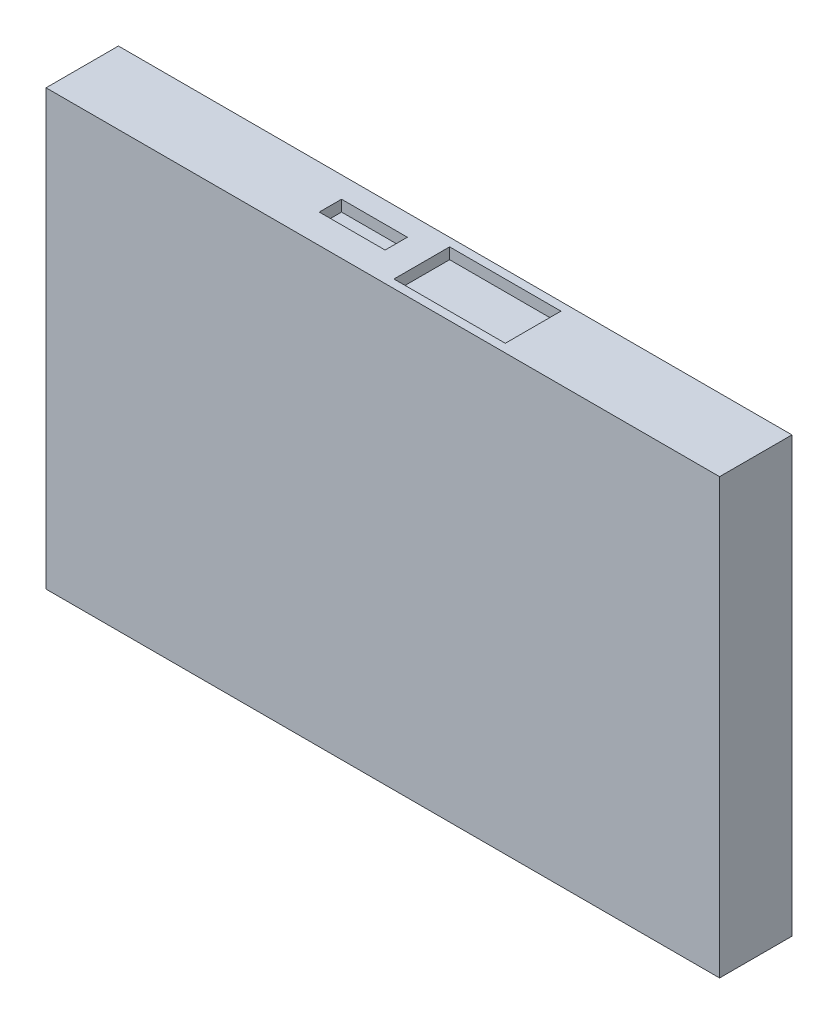
from build123d import *

# Parameters (mm, degrees)
SKETCH1_W           = 121
SKETCH1_H           = 78
BOSS_EXTRUDE1_DEPTH = 13
SKETCH2_W           = 115
SKETCH2_H           = 70
CUT_EXTRUDE1_DEPTH  = 1
SKETCH4_W           = 20
SKETCH4_H           = 10
SKETCH4_W_2         = 11.824806853
SKETCH4_H_2         = 3.99711781
CUT_EXTRUDE2_DEPTH  = 2


with BuildPart() as part:
    # Sketch1 → Boss-Extrude1 (new body)
    with BuildSketch(Plane.XY):
        with Locations((60.5, 39)):
            Rectangle(SKETCH1_W, SKETCH1_H)
    extrude(amount=BOSS_EXTRUDE1_DEPTH)

    # Sketch2 → Cut-Extrude1 (cut)
    with BuildSketch(Plane(origin=(0, 0, 0), x_dir=(-1, 0, 0), z_dir=(0, 0, -1))):
        with Locations((-60.5, 38)):
            Rectangle(SKETCH2_W, SKETCH2_H)
    extrude(amount=-CUT_EXTRUDE1_DEPTH, mode=Mode.SUBTRACT)

    # Sketch4 → Cut-Extrude2 (cut)
    with BuildSketch(Plane(origin=(0, 78, 0), x_dir=(1, 0, 0), z_dir=(0, 1, 0))):
        with Locations((71, -6.5)):
            Rectangle(SKETCH4_W, SKETCH4_H)
        with Locations((49.790852201, -5.791105027)):
            Rectangle(SKETCH4_W_2, SKETCH4_H_2)
    extrude(amount=-CUT_EXTRUDE2_DEPTH, mode=Mode.SUBTRACT)


solid = part.part
